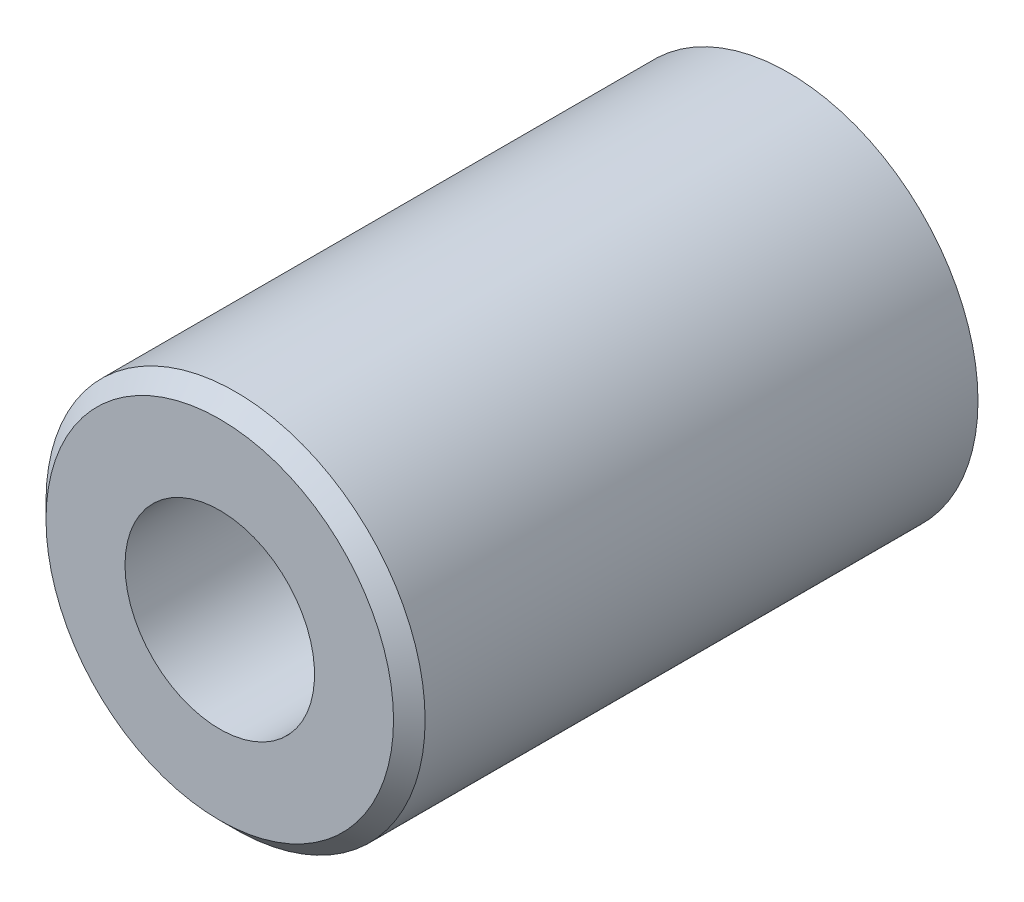
from build123d import *

# Parameters (mm, degrees)
SKETCH1_R      = 3.175
SKETCH1_R_2    = 1.5875
EXTRUDE1_DEPTH = 4.7625
CHAMFER1_SIZE  = 0.264583333


with BuildPart() as part:
    # Sketch1 → Extrude1 (new, symmetric)
    with BuildSketch(Plane.XY):
        with Locations(Location((0, 0, 0), (0, 0, 180))):
            Circle(SKETCH1_R)
        with Locations(Location((0, 0, 0), (0, 0, 180))):
            Circle(SKETCH1_R_2, mode=Mode.SUBTRACT)
    extrude(amount=EXTRUDE1_DEPTH, both=True)

    # Chamfer1
    chamfer1_edges = [part.edges().sort_by_distance(p)[0] for p in [
        (3.175, 0, 4.7625),
    ]]
    chamfer(chamfer1_edges, length=CHAMFER1_SIZE)


solid = part.part
